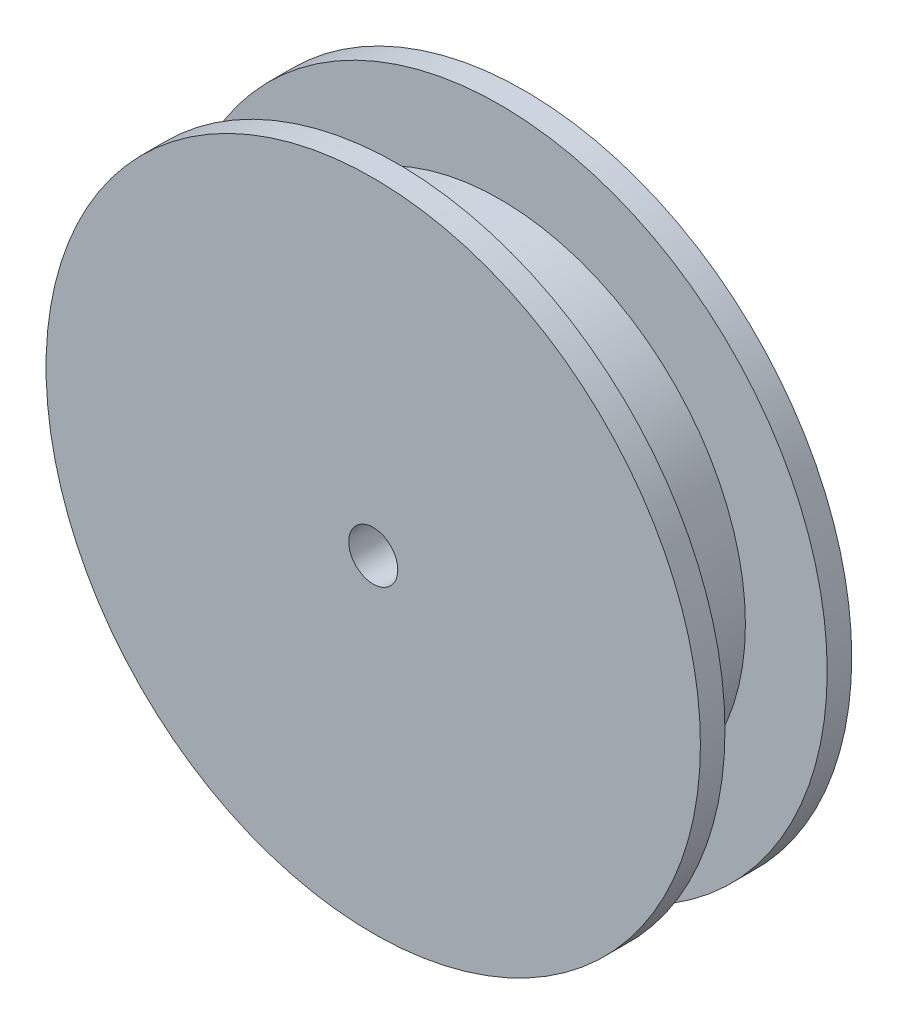
from build123d import *

# Parameters (mm, degrees)
SKETCH1_R               = 40
SKETCH1_R_2             = 30
SKETCH1_R_3             = 3
BOSS_EXTRUDE1_DEPTH     = 18.5
CUT_EXTRUDE1_DEPTH      = 6.25
CUT_EXTRUDE1_DEPTH_BACK = 6.25
SKETCH2_R               = 42.5
SKETCH2_R_2             = 30


with BuildPart() as part:
    # Sketch1 → Boss-Extrude1 (new body)
    # profile 1 of 2: a face of its own
    with BuildSketch(Plane.XY):
        Circle(SKETCH1_R)
        Circle(SKETCH1_R_2, mode=Mode.SUBTRACT)
    # profile 2 of 2: a face of its own
    with BuildSketch(Plane.XY):
        Circle(SKETCH1_R_2)
        Circle(SKETCH1_R_3, mode=Mode.SUBTRACT)
    extrude(amount=BOSS_EXTRUDE1_DEPTH)

    # Sketch2 → Cut-Extrude1 (cut, two sides: drawn at the far end of the back side and taken through both)
    with BuildSketch(Plane.XY.offset(9.25).offset(-CUT_EXTRUDE1_DEPTH_BACK)):
        Circle(SKETCH2_R)
        Circle(SKETCH2_R_2, mode=Mode.SUBTRACT)
    extrude(amount=CUT_EXTRUDE1_DEPTH + CUT_EXTRUDE1_DEPTH_BACK, mode=Mode.SUBTRACT)


solid = part.part
